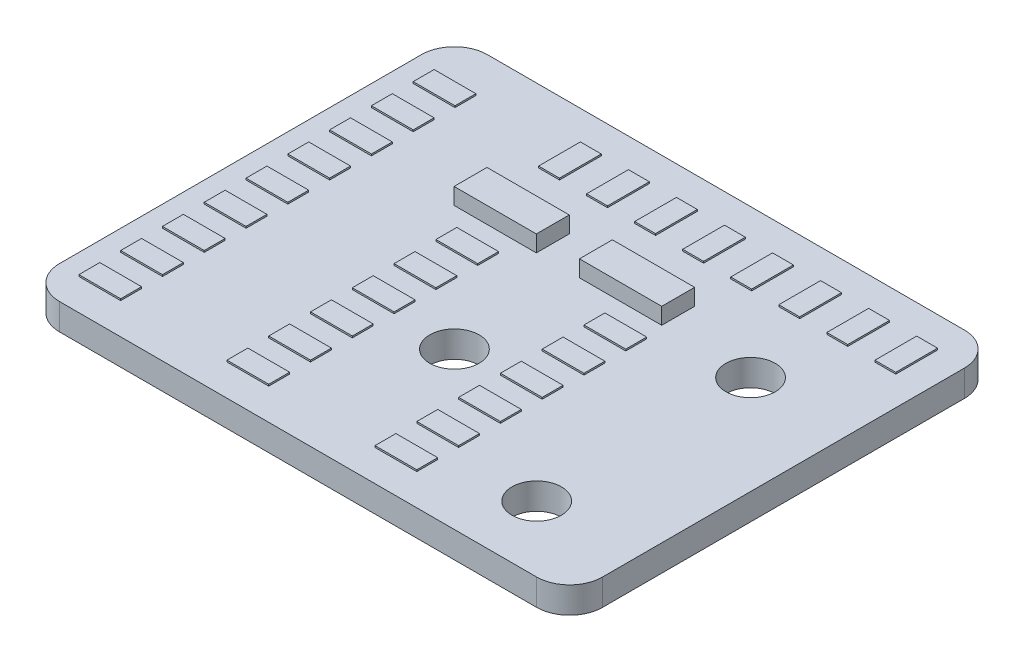
from build123d import *

# Parameters (mm, degrees)
SKETCH1_R           = 1.5
BOSS_EXTRUDE1_DEPTH = 1.6
SKETCH2_W           = 2.54
SKETCH2_H           = 1.27
SKETCH2_W_2         = 1.27
SKETCH2_H_2         = 2.54
BOSS_EXTRUDE2_DEPTH = 0.1
SKETCH3_W           = 5
SKETCH3_H           = 2
BOSS_EXTRUDE3_DEPTH = 1


with BuildPart() as part:
    # Sketch1 → Boss-Extrude1 (new body)
    with BuildSketch(Plane(origin=(0, 0, 0), x_dir=(1, 0, 0), z_dir=(0, 1, 0))):
        with BuildLine():
            Line((14.5, 13), (-14.5, 13))
            ThreePointArc((-14.5, 13), (-15.914213562, 12.414213562), (-16.5, 11))
            Line((-16.5, 11), (-16.5, -11))
            ThreePointArc((-16.5, -11), (-15.914213562, -12.414213562), (-14.5, -13))
            Line((-14.5, -13), (14.5, -13))
            ThreePointArc((14.5, -13), (15.914213562, -12.414213562), (16.5, -11))
            Line((16.5, -11), (16.5, 11))
            ThreePointArc((16.5, 11), (15.914213562, 12.414213562), (14.5, 13))
        make_face()
        with Locations(Location((0, -3.5, 0), (0, 0, 270))):
            Circle(SKETCH1_R, mode=Mode.SUBTRACT)
        with Locations(Location((10.5, 4, 0), (0, 0, 270))):
            Circle(SKETCH1_R, mode=Mode.SUBTRACT)
        with Locations(Location((10.5, -9, 0), (0, 0, 270))):
            Circle(SKETCH1_R, mode=Mode.SUBTRACT)
    extrude(amount=BOSS_EXTRUDE1_DEPTH)

    # Sketch2 → Boss-Extrude2 (add)
    with BuildSketch(Plane(origin=(0, 1.6, 0), x_dir=(1, 0, 0), z_dir=(0, 1, 0))):
        with Locations((-13.96, 9.86)):
            Rectangle(SKETCH2_W, SKETCH2_H)
        with Locations((-6.34, 9.86)):
            Rectangle(SKETCH2_W_2, SKETCH2_H_2)
        with Locations((-13.96, 7.32)):
            Rectangle(SKETCH2_W, SKETCH2_H)
        with Locations((-13.96, 4.78)):
            Rectangle(SKETCH2_W, SKETCH2_H)
        with Locations((-13.96, 2.24)):
            Rectangle(SKETCH2_W, SKETCH2_H)
        with Locations((-13.96, -0.3)):
            Rectangle(SKETCH2_W, SKETCH2_H)
        with Locations((-13.96, -2.84)):
            Rectangle(SKETCH2_W, SKETCH2_H)
        with Locations((-13.96, -5.38)):
            Rectangle(SKETCH2_W, SKETCH2_H)
        with Locations((-13.96, -7.92)):
            Rectangle(SKETCH2_W, SKETCH2_H)
        with Locations((-13.96, -10.46)):
            Rectangle(SKETCH2_W, SKETCH2_H)
        with Locations((-4.96, 2.24)):
            Rectangle(SKETCH2_W, SKETCH2_H)
        with Locations((-4.96, -0.3)):
            Rectangle(SKETCH2_W, SKETCH2_H)
        with Locations((-4.96, -2.84)):
            Rectangle(SKETCH2_W, SKETCH2_H)
        with Locations((-4.96, -5.38)):
            Rectangle(SKETCH2_W, SKETCH2_H)
        with Locations((-4.96, -7.92)):
            Rectangle(SKETCH2_W, SKETCH2_H)
        with Locations((-4.96, -10.46)):
            Rectangle(SKETCH2_W, SKETCH2_H)
        with Locations((4.04, 2.24)):
            Rectangle(SKETCH2_W, SKETCH2_H)
        with Locations((4.04, -0.3)):
            Rectangle(SKETCH2_W, SKETCH2_H)
        with Locations((4.04, -2.84)):
            Rectangle(SKETCH2_W, SKETCH2_H)
        with Locations((4.04, -5.38)):
            Rectangle(SKETCH2_W, SKETCH2_H)
        with Locations((4.04, -7.92)):
            Rectangle(SKETCH2_W, SKETCH2_H)
        with Locations((4.04, -10.46)):
            Rectangle(SKETCH2_W, SKETCH2_H)
        with Locations((-3.42, 9.86)):
            Rectangle(SKETCH2_W_2, SKETCH2_H_2)
        with Locations((-0.5, 9.86)):
            Rectangle(SKETCH2_W_2, SKETCH2_H_2)
        with Locations((2.42, 9.86)):
            Rectangle(SKETCH2_W_2, SKETCH2_H_2)
        with Locations((5.34, 9.86)):
            Rectangle(SKETCH2_W_2, SKETCH2_H_2)
        with Locations((8.26, 9.86)):
            Rectangle(SKETCH2_W_2, SKETCH2_H_2)
        with Locations((11.18, 9.86)):
            Rectangle(SKETCH2_W_2, SKETCH2_H_2)
        with Locations((14.1, 9.86)):
            Rectangle(SKETCH2_W_2, SKETCH2_H_2)
    extrude(amount=BOSS_EXTRUDE2_DEPTH)

    # Sketch3 → Boss-Extrude3 (add)
    with BuildSketch(Plane(origin=(0, 1.6, 0), x_dir=(1, 0, 0), z_dir=(0, 1, 0))):
        with Locations((-5.07, 5.05)):
            Rectangle(SKETCH3_W, SKETCH3_H)
        with Locations((2.55, 5.05)):
            Rectangle(SKETCH3_W, SKETCH3_H)
    extrude(amount=BOSS_EXTRUDE3_DEPTH)


solid = part.part
